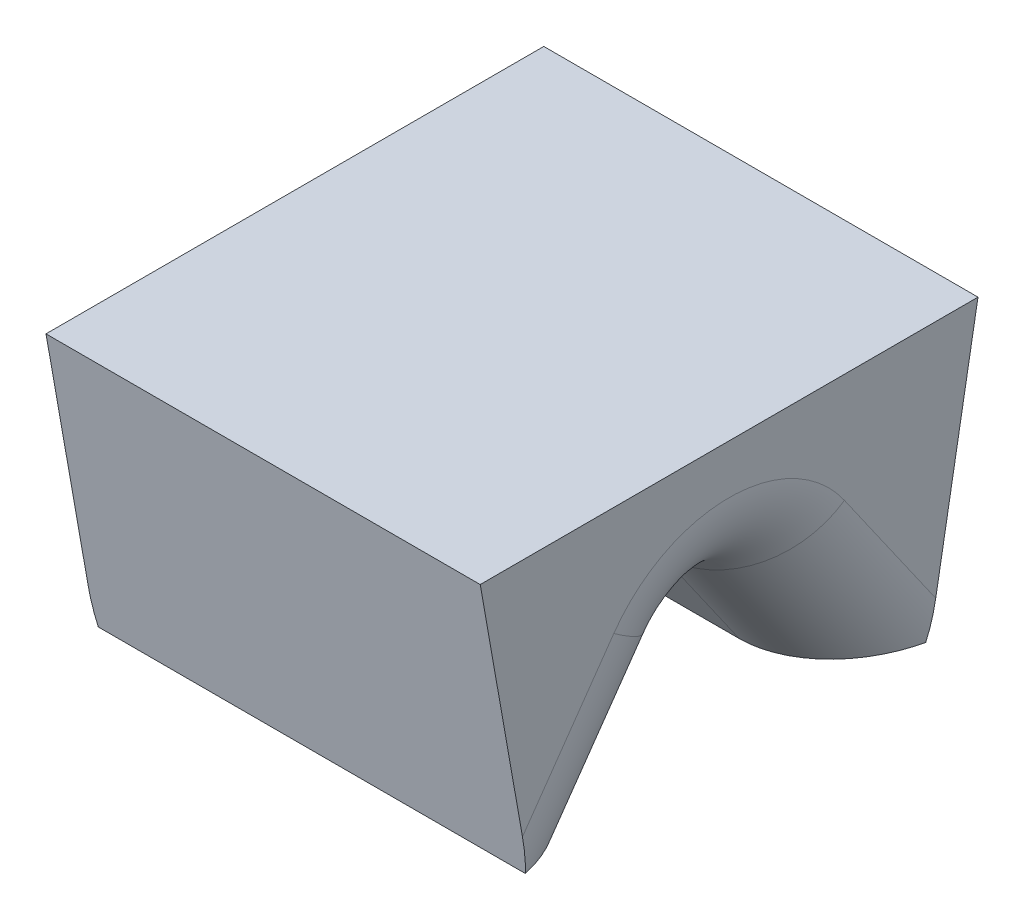
from build123d import *

# Parameters (mm, degrees)
SKETCH_TL_CUTTING_R    = 1.4986
TL_CUTTING_DEPTH       = 29.999999944
SKETCH_TDF_CUTTING_W   = 3.01719996
SKETCH_TDF_CUTTING_H   = 3.01719996
TDF_CUTTING_DEPTH      = 31.074766841
VW_VR_GRINDING_DEPTH   = 1.50859998
VW_VR_GRINDING_2_DEPTH = 1.50859998
ISA_GRINDING_DEPTH     = 1.50859998
SKETCH_PRE_FRX_BRX_W   = 1.16348002
SKETCH_PRE_FRX_BRX_H   = 0.89916
SKETCH_PRE_FRX_BRX_W_2 = 1.19347996
PRE_FRX_BRX_DEPTH      = 1.50859998
FA_BA_GRINDING_DEPTH   = 1.50859998
BR_EDM_R               = 0.14986
FR_EDM_R               = 0.14986


with BuildPart() as part:
    # sketch_TL_cutting → TL_cutting (new body)
    with BuildSketch(Plane(origin=(0, 0, 0), x_dir=(1, 0, 0), z_dir=(0, 1, 0))):
        with Locations(Location((0, 0, 0), (0, 0, 270))):
            Circle(SKETCH_TL_CUTTING_R)
    extrude(amount=TL_CUTTING_DEPTH)

    # sketch_TDF_cutting → TDF_cutting (cut, through all)
    with BuildSketch(Plane(origin=(0, 0, 0), x_dir=(1, 0, 0), z_dir=(0, 1, 0))):
        with Locations((-2.71001998, 0)):
            Rectangle(SKETCH_TDF_CUTTING_W, SKETCH_TDF_CUTTING_H)
    extrude(amount=TDF_CUTTING_DEPTH, mode=Mode.SUBTRACT)


with BuildPart() as body_2:
    # sketch_VW_VR_grinding → VW_VR_grinding (new, symmetric)
    with BuildSketch(Plane(origin=(0, 0, 0), x_dir=(0, 0, -1), z_dir=(1, 0, 0))):
        with BuildLine():
            Line((-1.49360001, -0.00999998), (-1.49360001, 0.888048914))
            ThreePointArc((-1.49360001, 0.888048914), (-1.493648337, 0.889155792), (-1.493792952, 0.890254246))
            Line((-1.493792952, 0.890254246), (-1.51859996, 1.030941782))
            Line((-1.51859996, 1.030941782), (-1.50859998, -0.00999998))
            Line((-1.50859998, -0.00999998), (-1.49360001, -0.00999998))
        make_face()
    extrude(amount=VW_VR_GRINDING_DEPTH, both=True)


with BuildPart() as body_3:
    # sketch_VW_VR_grinding → VW_VR_grinding 2 (new, symmetric)
    with BuildSketch(Plane(origin=(0, 0, 0), x_dir=(0, 0, -1), z_dir=(1, 0, 0))):
        with BuildLine():
            Line((1.49360001, -0.00999998), (1.49360001, 0.888048914))
            ThreePointArc((1.49360001, 0.888048914), (1.493648337, 0.889155792), (1.493792952, 0.890254246))
            Line((1.493792952, 0.890254246), (1.51859996, 1.030941782))
            Line((1.51859996, 1.030941782), (1.50859998, -0.00999998))
            Line((1.50859998, -0.00999998), (1.49360001, -0.00999998))
        make_face()
    extrude(amount=VW_VR_GRINDING_2_DEPTH, both=True)


    add(body_2.part)  # ISA_grinding merges body 2
    # sketch_ISA_grinding → ISA_grinding (add, symmetric)
    with BuildSketch(Plane(origin=(0, 0, 0), x_dir=(0, 0, -1), z_dir=(1, 0, 0))):
        Polygon((-0.29972, 0), (0.29972, 0), (1.50859998, 6.855899053), (1.50859998, -0.02999994), (-1.50859998, -0.02999994), (-1.50859998, 6.855899053), align=None)
    extrude(amount=ISA_GRINDING_DEPTH, both=True)

    # sketch_pre_FRX_BRX → pre_FRX_BRX (add, symmetric)
    with BuildSketch(Plane.XY):
        with Locations((0.91685999, 0.43958002)):
            Rectangle(SKETCH_PRE_FRX_BRX_W, SKETCH_PRE_FRX_BRX_H)
        with Locations((-0.92185998, 0.43958002)):
            Rectangle(SKETCH_PRE_FRX_BRX_W_2, SKETCH_PRE_FRX_BRX_H)
    extrude(amount=PRE_FRX_BRX_DEPTH, both=True)

    # sketch_FA_BA_grinding → FA_BA_grinding (add, symmetric)
    with BuildSketch(Plane.XY):
        Polygon((0.32512, -0.00999998), (0.32512, 0.89916), (1.6256, 10.152556017), (1.6256, -0.00999998), align=None)
        Polygon((-0.32512, -0.00999998), (-0.32512, 0.89916), (-1.32842, 8.038010442), (-1.32842, -0.00999998), align=None)
    extrude(amount=FA_BA_GRINDING_DEPTH, both=True)


with BuildPart() as part_1:
    add(part.part)

    # B1_fix: cut body 3
    add(body_3.part, mode=Mode.SUBTRACT)

    # V-Groove_EDM: sweep along a path in sketch_contour_V-Groove
    with BuildLine(Plane.XY) as v_groove_edm_path:
        Line((-1.20142, 0.1905), (1.4986, 0.1905))
    # sketch_section_V-Groove → V-Groove_EDM (sweep, cut)
    with BuildSketch(Plane(origin=(-1.20142, 0, -1.2954), x_dir=(0, 0, -1), z_dir=(1, 0, 0))):
        with BuildLine():
            Line((-1.245464491, 0.16450522), (-1.123274635, -0.00999998))
            Line((-1.123274635, -0.00999998), (-1.467525365, -0.00999998))
            Line((-1.467525365, -0.00999998), (-1.345335509, 0.16450522))
            ThreePointArc((-1.345335509, 0.16450522), (-1.2954, 0.1905), (-1.245464491, 0.16450522))
        make_face()
    sweep(path=v_groove_edm_path.line, mode=Mode.SUBTRACT)

    # BR_EDM
    br_edm_edges = [part_1.edges().sort_by_distance(p)[0] for p in [
        (-0.32512, 0.1905, 0),
        (-0.32512, 0.08225261, -0.107529406),
        (-0.32512, 0.08225261, 0.107529406),
    ]]
    fillet(br_edm_edges, radius=BR_EDM_R)

    # FR_EDM
    fr_edm_edges = [part_1.edges().sort_by_distance(p)[0] for p in [
        (0.32512, 0.08225261, -0.107529406),
        (0.32512, 0.08225261, 0.107529406),
        (0.32512, 0.1905, 0),
    ]]
    fillet(fr_edm_edges, radius=FR_EDM_R)

    # SurfaceCut1
    split(bisect_by=Plane(origin=(0, 0.41401793, 0), x_dir=(1, 0, 0), z_dir=(0, 1, 0)), keep=Keep.BOTTOM)


solid = part_1.part
